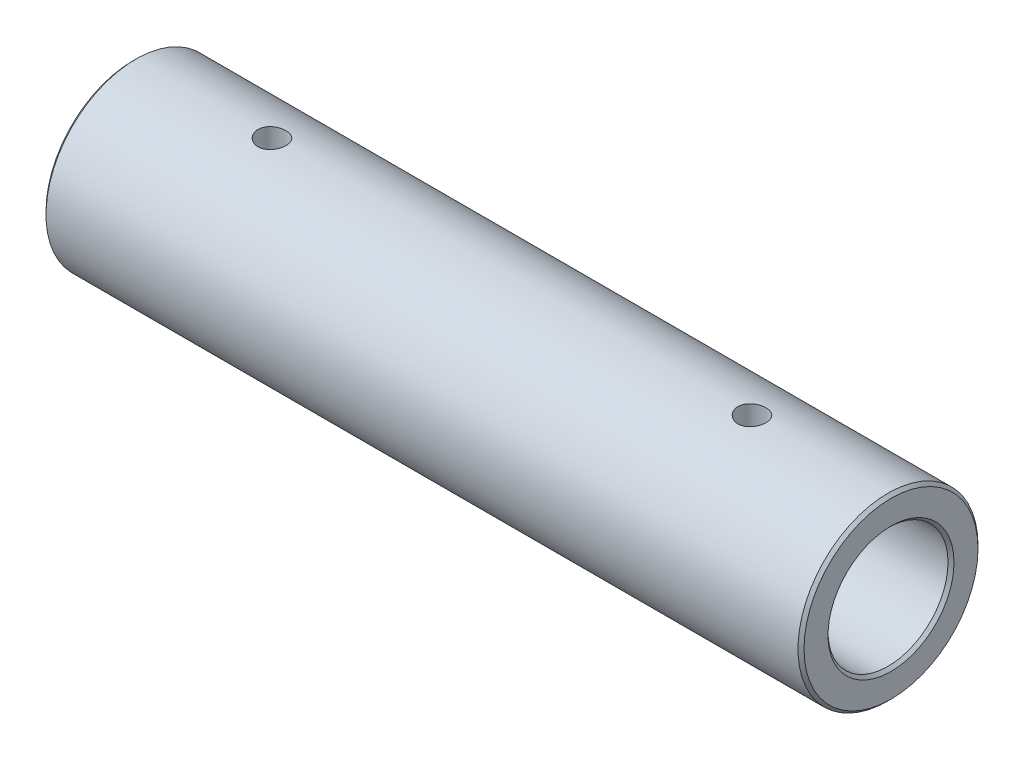
from build123d import *

# Parameters (mm, degrees)
SKETCH_1_R              = 45
SKETCH_1_R_2            = 30
EXTRUDE_1_DEPTH         = 379
CHAMFER_1_SIZE          = 1.5
HOLE_WIZARD_M16_2_D     = 14
HOLE_WIZARD_M16_2_DEPTH = 42
HOLE_WIZARD_M16_2_TIP   = 4.206024333


with BuildPart() as part:
    # 草图1 → 凸台-拉伸1 (new body)
    with BuildSketch(Plane(origin=(0, 0, 0), x_dir=(0, 0, -1), z_dir=(1, 0, 0))):
        Circle(SKETCH_1_R)
        Circle(SKETCH_1_R_2, mode=Mode.SUBTRACT)
    extrude(amount=EXTRUDE_1_DEPTH)

    # 倒角1
    chamfer_1_edges = [part.edges().sort_by_distance(p)[0] for p in [
        (0, 0, 45),
        (379, 0, 45),
        (0, 0, 30),
        (379, 0, 30),
    ]]
    chamfer(chamfer_1_edges, length=CHAMFER_1_SIZE)

    # M16 螺纹孔2
    with Locations(Plane(origin=(0, 45, 0), x_dir=(1, 0, 0), z_dir=(0, 1, 0))):
        with Locations((69.5, 0), (309.5, 0)):
            Hole(HOLE_WIZARD_M16_2_D / 2, depth=HOLE_WIZARD_M16_2_DEPTH)
            with Locations((0, 0, -(HOLE_WIZARD_M16_2_DEPTH + HOLE_WIZARD_M16_2_TIP / 2))):  # 118° drill point
                Cone(0, HOLE_WIZARD_M16_2_D / 2, HOLE_WIZARD_M16_2_TIP, mode=Mode.SUBTRACT)


solid = part.part
